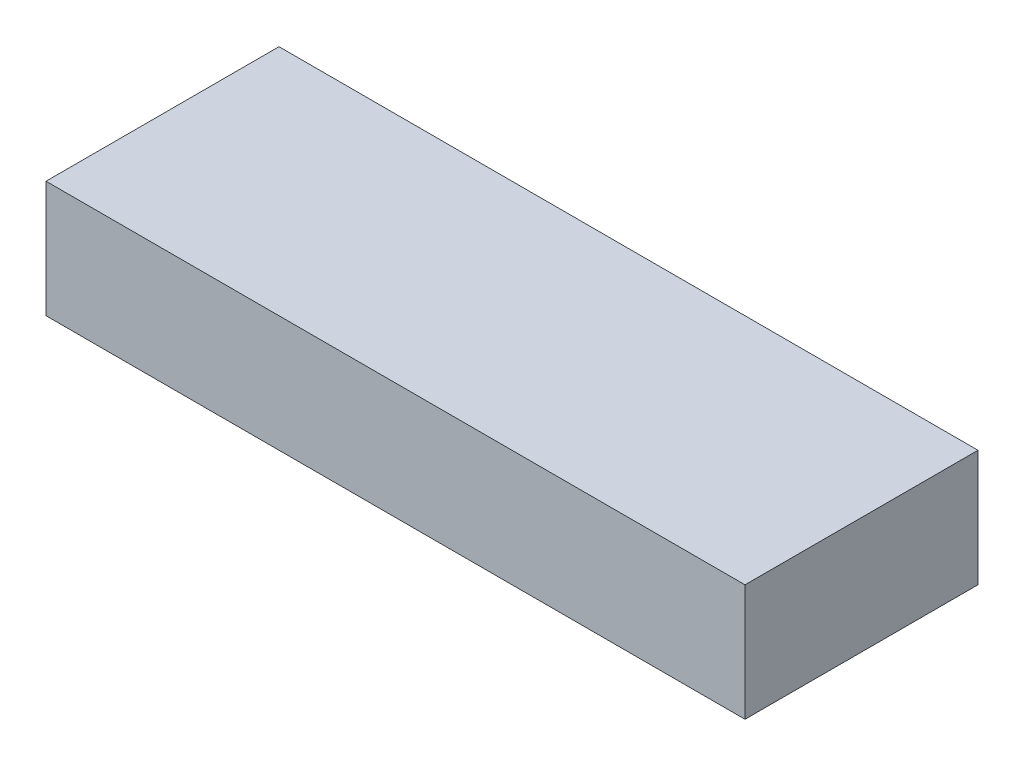
from build123d import *

# Parameters (mm, degrees)
SKETCH_1_W      = 6
SKETCH_1_H      = 1
EXTRUDE_1_DEPTH = 2


with BuildPart() as part:
    # 草图1 → 凸台-拉伸1 (new body)
    with BuildSketch(Plane.XY):
        with Locations((-2.250327282, 1.5)):
            Rectangle(SKETCH_1_W, SKETCH_1_H)
    extrude(amount=EXTRUDE_1_DEPTH)


solid = part.part
